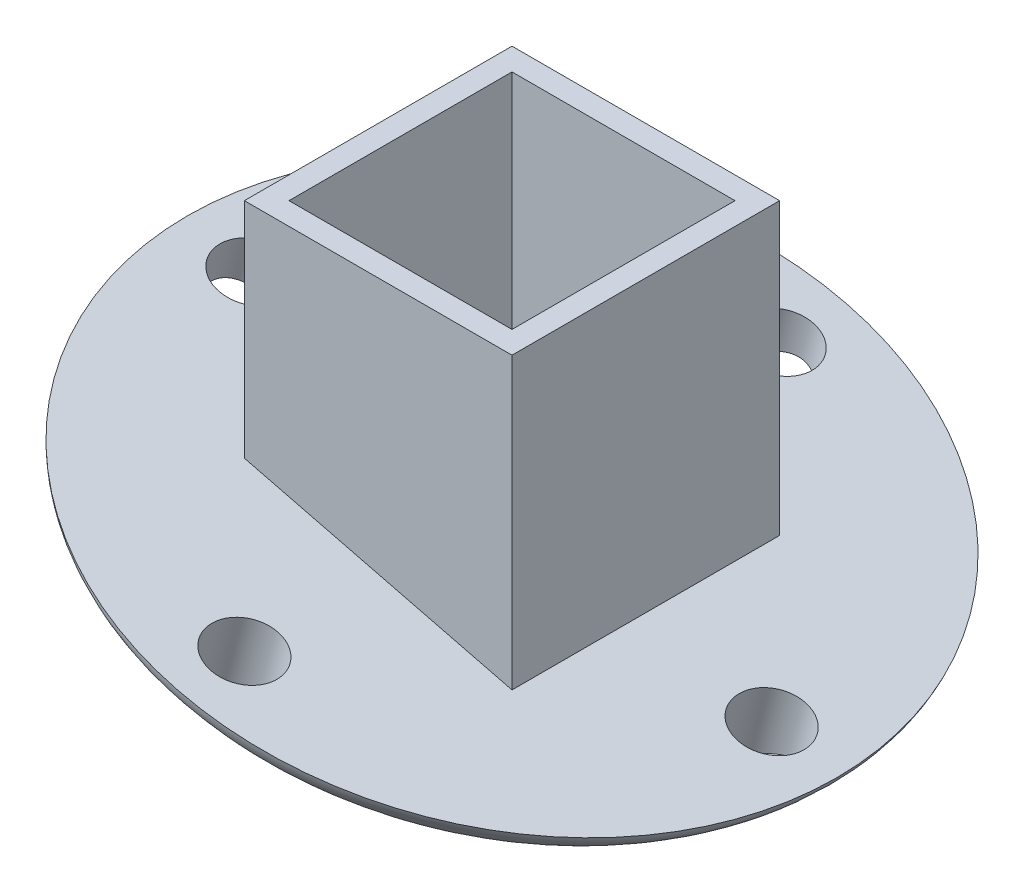
from build123d import *

# Parameters (mm, degrees)
SKETCH_1_W          = 12
SKETCH_1_H          = 12
SKETCH_1_W_2        = 10
SKETCH_1_H_2        = 10
EXTRUDE_1_DEPTH     = 10
SKETCH_2_W          = 12
SKETCH_2_H          = 3
EXTRUDE_2_DEPTH     = 12
CUT_EXTRUDE_1_DEPTH = 12
SKETCH_13_R         = 1.5
CUT_EXTRUDE_3_DEPTH = 5


with BuildPart() as part:
    # 草图1 → 凸台-拉伸1 (new body)
    with BuildSketch(Plane(origin=(0, 0, 0), x_dir=(1, 0, 0), z_dir=(0, 1, 0))):
        Rectangle(SKETCH_1_W, SKETCH_1_H)
        Rectangle(SKETCH_1_W_2, SKETCH_1_H_2, mode=Mode.SUBTRACT)
    extrude(amount=EXTRUDE_1_DEPTH)

    # 草图2 → 凸台-拉伸2 (add)
    with BuildSketch(Plane(origin=(6, 0, 0), x_dir=(0, 0, -1), z_dir=(1, 0, 0))):
        with Locations((0, -1.5)):
            Rectangle(SKETCH_2_W, SKETCH_2_H)
    extrude(amount=-EXTRUDE_2_DEPTH)

    # 草图3 → 切除-拉伸1 (cut)
    with BuildSketch(Plane.XY.offset(6)):
        Polygon((-6, -3), (6, -3), (-6, 0), align=None)
    extrude(amount=-CUT_EXTRUDE_1_DEPTH, mode=Mode.SUBTRACT)

    # 草图12 → 旋转2 (revolve)
    with BuildSketch(Plane.XY):
        with BuildLine():
            Line((6, -3), (0, -1.5))
            Line((0, -1.5), (-1.212678125, -6.350712501))
            add(Edge.make_bspline(
                [(-1.212678125, -6.350712501), (4.875851895, -8.181828142), (13.57045187, -7.289924983), (14.552137502, -5.138034376)],
                knots=[0, 0, 0, 0, 1, 1, 1, 1], degree=3))
            Line((14.552137502, -5.138034376), (6, -3))
        make_face()
    revolve(axis=Axis((0, -1.5, 0), (-0.24253562503633272, -0.970142500145332, 0)))

    # 草图13 → 切除-拉伸3 (cut)
    with BuildSketch(Plane(origin=(-0.352941176, -1.411764706, 0), x_dir=(0.970142500145332, -0.24253562503633286, 0), z_dir=(0.24253562503633286, 0.970142500145332, 0))):
        with Locations(Location((0.363964271, 12.000163805, 0), (0, 0, 180))):
            Circle(SKETCH_13_R)
        with Locations(Location((12.363964271, 0.000163805, 0), (0, 0, 180))):
            Circle(SKETCH_13_R)
        with Locations(Location((0.363964271, -11.999836195, 0), (0, 0, 180))):
            Circle(SKETCH_13_R)
        with Locations(Location((-11.636035729, 0.000163805, 0), (0, 0, 180))):
            Circle(SKETCH_13_R)
    extrude(amount=-CUT_EXTRUDE_3_DEPTH, mode=Mode.SUBTRACT)


solid = part.part
